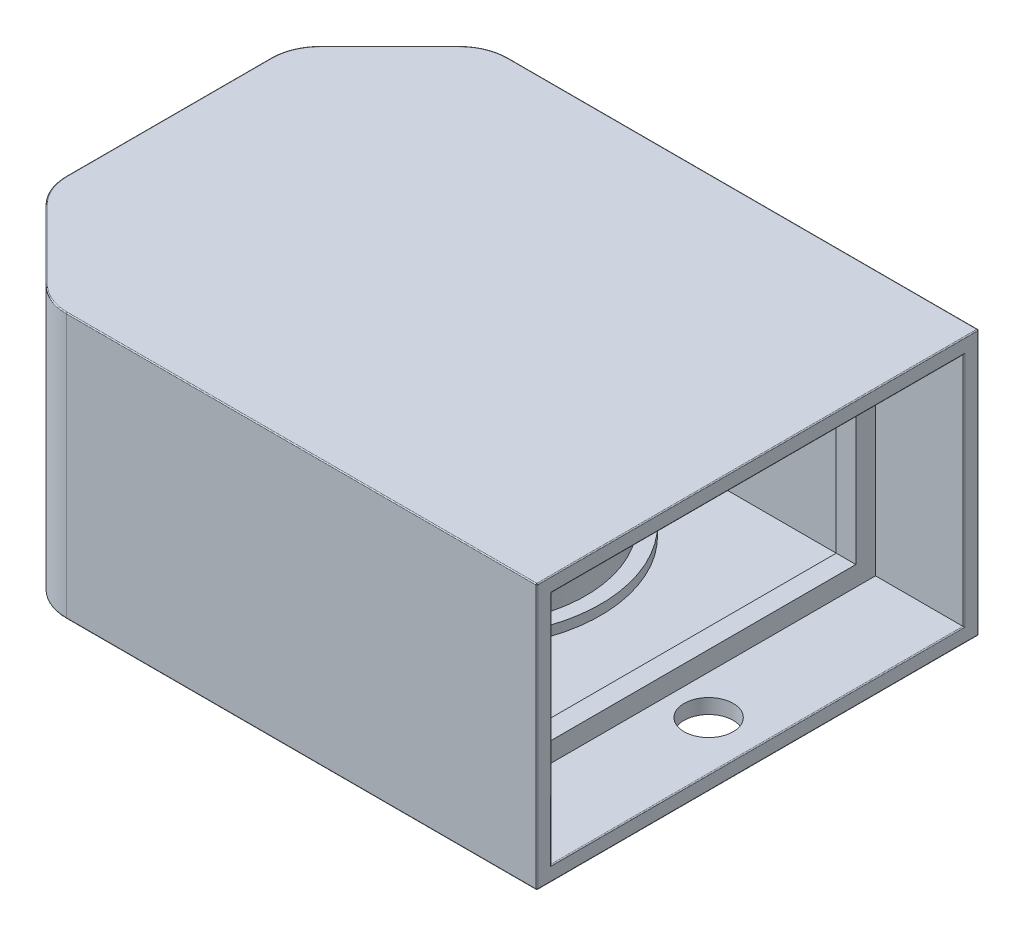
from build123d import *

# Parameters (mm, degrees)
SKETCH_1_W          = 60
SKETCH_1_H          = 45
EXTRUDE_1_DEPTH     = 13.5
CHAMFER_1_SIZE      = 10
FILLET_1_R          = 5
SHELL_1_T           = -1.5
FILLET_2_R          = 0.1
SKETCH_4_W          = 42
SKETCH_4_H          = 24
SKETCH_4_W_2        = 38
SKETCH_4_H_2        = 20
EXTRUDE_1_2_DEPTH   = 1
CUT_EXTRUDE_1_REACH = 47.349
SKETCH_7_R          = 2.5


with BuildPart() as part:
    # 草图1 → Extrude 1 (new, symmetric)
    with BuildSketch(Plane(origin=(0, 0, 0), x_dir=(1, 0, 0), z_dir=(0, 1, 0))):
        Rectangle(SKETCH_1_W, SKETCH_1_H)
    extrude(amount=EXTRUDE_1_DEPTH, both=True)

    # 倒角1
    chamfer_1_edges = [part.edges().sort_by_distance(p)[0] for p in [
        (-30, 0, 22.5),
        (-30, 0, -22.5),
    ]]
    chamfer(chamfer_1_edges, length=CHAMFER_1_SIZE)

    # 圆角1
    fillet_1_edges = [part.edges().sort_by_distance(p)[0] for p in [
        (-30, 0, 12.5),
        (-30, 0, -12.5),
        (-20, 0, -22.5),
        (-20, 0, 22.5),
    ]]
    fillet(fillet_1_edges, radius=FILLET_1_R)

    # 抽壳1
    shell_1_openings = [part.faces().sort_by_distance(p)[0] for p in [
        (30, 0, 0),
    ]]
    offset(amount=SHELL_1_T, openings=shell_1_openings, kind=Kind.INTERSECTION)

    # 圆角2
    fillet_2_edges = [part.edges().sort_by_distance(p)[0] for p in [
        (-25, 13.5, -17.5),
        (-30, 13.5, 0),
        (-25, 13.5, 17.5),
        (6.035533906, 13.5, 22.5),
        (-19.84234935, 13.5, 22.119397663),
        (-29.619397663, 13.5, 12.34234935),
        (-29.619397663, 13.5, -12.34234935),
        (-19.84234935, 13.5, -22.119397663),
        (-25, -13.5, -17.5),
        (-30, -13.5, 0),
        (6.035533906, -13.5, 22.5),
        (-25, -13.5, 17.5),
        (-19.84234935, -13.5, 22.119397663),
        (-29.619397663, -13.5, 12.34234935),
        (-29.619397663, -13.5, -12.34234935),
        (-19.84234935, -13.5, -22.119397663),
        (30, 13.5, 0),
        (6.035533906, -13.5, -22.5),
        (30, -12, 0),
        (30, 0, 21),
        (30, 0, -21),
        (30, 12, 0),
        (30, -13.5, 0),
        (6.035533906, 13.5, -22.5),
        (30, 0, 22.5),
        (30, 0, -22.5),
    ]]
    fillet(fillet_2_edges, radius=FILLET_2_R)

    # 草图3 → 旋转1 (revolve)
    with BuildSketch(Plane.XY, mode=Mode.PRIVATE) as revolve_1_sk:
        Polygon((0, 12), (4, 12), (4, 3.5), (14, 3.5), (14, 2.5), (12.5, 2.5), (12.5, -7.5), (14, -7.5), (14, -8.5), (4, -8.5), (4, -12), (0, -12), align=None)
    revolve(revolve_1_sk.sketch.rotate(Axis((0, 13.4, 0), (0, -1, 0)), 90), axis=Axis((0, 13.4, 0), (0, -1, 0)))

    # 草图4 → Extrude 1 2 (add, symmetric)
    with BuildSketch(Plane(origin=(20, 0, 0), x_dir=(0, 0, -1), z_dir=(1, 0, 0))):
        Rectangle(SKETCH_4_W, SKETCH_4_H)
        Rectangle(SKETCH_4_W_2, SKETCH_4_H_2, mode=Mode.SUBTRACT)
    extrude(amount=EXTRUDE_1_2_DEPTH, both=True)

    # 草图7 → 切除-拉伸1 (cut, up to next)
    with BuildSketch(Plane(origin=(0, -12, 0), x_dir=(1, 0, 0), z_dir=(0, 1, 0)), mode=Mode.PRIVATE) as cut_extrude_1_sk1:
        with Locations(Location((25, 0, 0), (0, 0, 270))):
            Circle(SKETCH_7_R)
    cut_extrude_1_tool1 = extrude(cut_extrude_1_sk1.sketch, amount=-CUT_EXTRUDE_1_REACH, mode=Mode.PRIVATE) & part.part
    add(cut_extrude_1_tool1.solids().sort_by_distance((25, -12, 0))[0], mode=Mode.SUBTRACT)


solid = part.part
